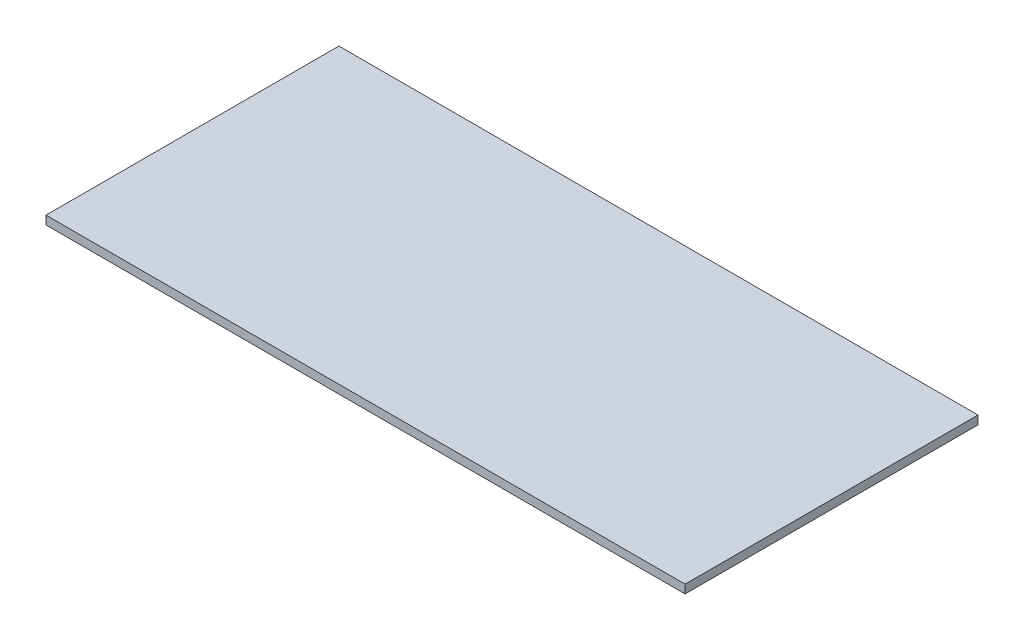
from build123d import *

# Parameters (mm, degrees)
SKETCH1_W           = 120
SKETCH1_H           = 55
PLATE_EXTRUDE_DEPTH = 1.6


with BuildPart() as part:
    # Sketch1 → Plate_Extrude (new body)
    with BuildSketch(Plane(origin=(0, 0, 0), x_dir=(1, 0, 0), z_dir=(0, 1, 0))):
        Rectangle(SKETCH1_W, SKETCH1_H)
    extrude(amount=PLATE_EXTRUDE_DEPTH)


solid = part.part
